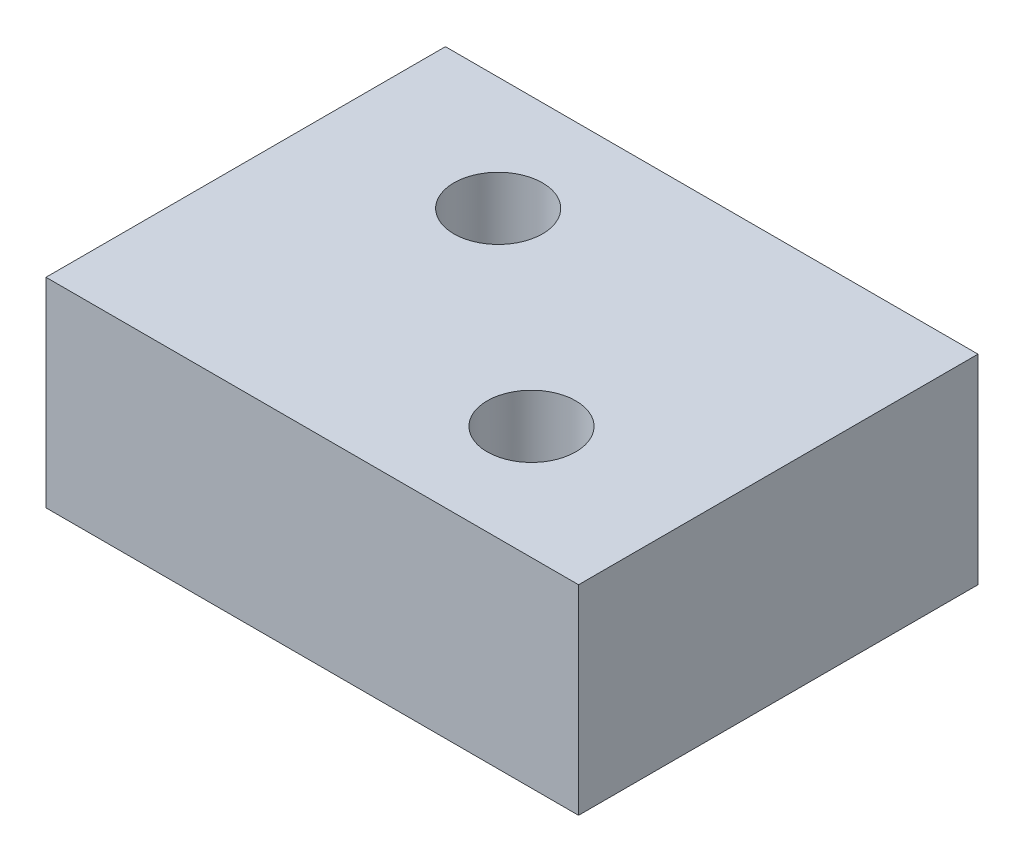
from build123d import *

# Parameters (mm, degrees)
SKETCH2_W               = 40
SKETCH2_H               = 30
BOSS_EXTRUDE1_DEPTH     = 10
SKETCH3_R               = 2
CUT_EXTRUDE1_DEPTH      = 5
SKETCH4_R               = 4.8125
CUT_EXTRUDE2_DEPTH      = 4
SKETCH8_W               = 40
SKETCH8_H               = 30
BOSS_EXTRUDE2_DEPTH     = 5
CUT_EXTRUDE3_DEPTH      = 27.570660511
CUT_EXTRUDE3_DEPTH_BACK = 1
SKETCH7_R               = 3.325


with BuildPart() as part:
    # Sketch2 → Boss-Extrude1 (new body)
    with BuildSketch(Plane(origin=(0, 0, 0), x_dir=(1, 0, 0), z_dir=(0, 1, 0))):
        Rectangle(SKETCH2_W, SKETCH2_H)
    extrude(amount=BOSS_EXTRUDE1_DEPTH)

    # Sketch3 → Cut-Extrude1 (cut)
    with BuildSketch(Plane(origin=(0, 0, 0), x_dir=(-1, 0, 0), z_dir=(0, -1, 0))):
        with Locations(Location((-13.333333333, -10, 0), (0, 0, 90))):
            Circle(SKETCH3_R)
        with Locations(Location((13.333333333, -10, 0), (0, 0, 270))):
            Circle(SKETCH3_R)
        with Locations(Location((-13.333333333, 10, 0), (0, 0, 270))):
            Circle(SKETCH3_R)
        with Locations(Location((13.333333333, 10, 0), (0, 0, 90))):
            Circle(SKETCH3_R)
    extrude(amount=-CUT_EXTRUDE1_DEPTH, mode=Mode.SUBTRACT)

    # Sketch4 → Cut-Extrude2 (cut)
    with BuildSketch(Plane(origin=(0, 10, 0), x_dir=(1, 0, 0), z_dir=(0, 1, 0))):
        with Locations(Location((7.9286, -6.465, 0), (0, 0, 270))):
            Circle(SKETCH4_R)
        with Locations(Location((-7.5, 6.4636, 0), (0, 0, 270))):
            Circle(SKETCH4_R)
    extrude(amount=-CUT_EXTRUDE2_DEPTH, mode=Mode.SUBTRACT)

    # Sketch8 → Boss-Extrude2 (add)
    with BuildSketch(Plane(origin=(0, 10, 0), x_dir=(1, 0, 0), z_dir=(0, 1, 0))):
        Rectangle(SKETCH8_W, SKETCH8_H)
    extrude(amount=BOSS_EXTRUDE2_DEPTH)

    # Sketch7 → Cut-Extrude3 (cut, two sides: drawn at the far end of the back side and taken through both)
    with BuildSketch(Plane(origin=(0, 6, 0), x_dir=(1, 0, 0), z_dir=(0, 1, 0)).offset(-CUT_EXTRUDE3_DEPTH_BACK)):
        with Locations(Location((7.9286, -6.465, 0), (0, 0, 90))):
            Circle(SKETCH7_R)
        with Locations(Location((-7.5, 6.4636, 0), (0, 0, 90))):
            Circle(SKETCH7_R)
    extrude(amount=CUT_EXTRUDE3_DEPTH + CUT_EXTRUDE3_DEPTH_BACK, mode=Mode.SUBTRACT)


solid = part.part
